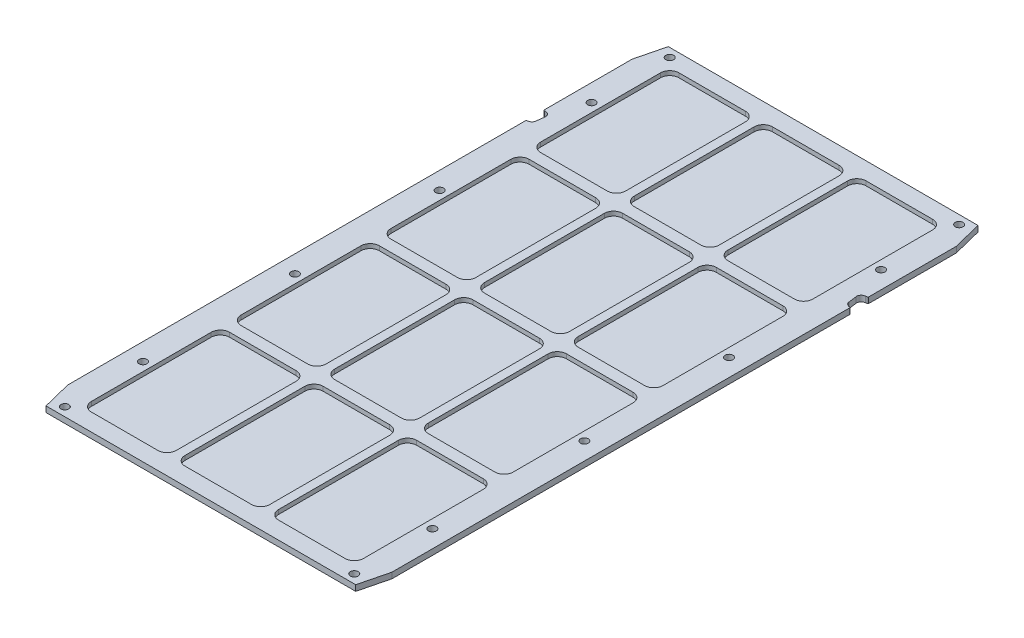
from build123d import *

# Parameters (mm, degrees)
SKETCH1_W           = 112
SKETCH1_H           = 215
BOSS_EXTRUDE1_DEPTH = 2
SKETCH2_W           = 29.333333333
SKETCH2_H           = 47.75
SKETCH2_W_2         = 29.333333334
CUT_EXTRUDE1_DEPTH  = 1.5
CUT_EXTRUDE2_DEPTH  = 122.228090804
SKETCH4_R           = 1.35
CUT_EXTRUDE3_DEPTH  = 122.228090804
FILLET1_R           = 3.175
FILLET2_R           = 3.175
CUT_EXTRUDE4_DEPTH  = 122.228090804
FILLET3_R           = 0.3


with BuildPart() as part:
    # Sketch1 → Boss-Extrude1 (new body)
    with BuildSketch(Plane(origin=(0, 0, 0), x_dir=(1, 0, 0), z_dir=(0, 1, 0))):
        Rectangle(SKETCH1_W, SKETCH1_H)
    extrude(amount=BOSS_EXTRUDE1_DEPTH)

    # Sketch2 → Cut-Extrude1 (cut)
    with BuildSketch(Plane(origin=(0, 2, 0), x_dir=(1, 0, 0), z_dir=(0, 1, 0))):
        with Locations((-32.333333334, 77.625)):
            Rectangle(SKETCH2_W, SKETCH2_H)
        with Locations((-32.333333334, 25.875)):
            Rectangle(SKETCH2_W, SKETCH2_H)
        with Locations((0, 77.625)):
            Rectangle(SKETCH2_W_2, SKETCH2_H)
        with Locations((0, 25.875)):
            Rectangle(SKETCH2_W_2, SKETCH2_H)
        with Locations((-32.333333334, -25.875)):
            Rectangle(SKETCH2_W, SKETCH2_H)
        with Locations((32.333333334, 77.625)):
            Rectangle(SKETCH2_W, SKETCH2_H)
        with Locations((32.333333334, 25.875)):
            Rectangle(SKETCH2_W, SKETCH2_H)
        with Locations((0, -25.875)):
            Rectangle(SKETCH2_W_2, SKETCH2_H)
        with Locations((32.333333334, -25.875)):
            Rectangle(SKETCH2_W, SKETCH2_H)
        with Locations((32.333333334, -77.625)):
            Rectangle(SKETCH2_W, SKETCH2_H)
        with Locations((0, -77.625)):
            Rectangle(SKETCH2_W_2, SKETCH2_H)
        with Locations((-32.333333334, -77.625)):
            Rectangle(SKETCH2_W, SKETCH2_H)
    extrude(amount=-CUT_EXTRUDE1_DEPTH, mode=Mode.SUBTRACT)

    # Sketch3 → Cut-Extrude2 (cut, through all)
    with BuildSketch(Plane(origin=(0, 2, 0), x_dir=(1, 0, 0), z_dir=(0, 1, 0))):
        Polygon((-56, 107.5), (-53.5, 107.5), (-56, 97.5), align=None)
        Polygon((56, 107.5), (53.5, 107.5), (56, 97.5), align=None)
        Polygon((56, -107.5), (56, -97.5), (53.5, -107.5), align=None)
        Polygon((-56, -107.5), (-56, -97.5), (-53.5, -107.5), align=None)
    extrude(amount=-CUT_EXTRUDE2_DEPTH, mode=Mode.SUBTRACT)

    # Sketch4 → Cut-Extrude3 (cut, through all)
    with BuildSketch(Plane(origin=(0, 2, 0), x_dir=(1, 0, 0), z_dir=(0, 1, 0))):
        with Locations(Location((-50, 104.5, 0), (0, 0, 270))):
            Circle(SKETCH4_R)
        with Locations(Location((-50, -104.5, 0), (0, 0, 270))):
            Circle(SKETCH4_R)
        with Locations(Location((50, -104.5, 0), (0, 0, 90))):
            Circle(SKETCH4_R)
        with Locations(Location((50, -25, 0), (0, 0, 90))):
            Circle(SKETCH4_R)
        with Locations(Location((50, 25, 0), (0, 0, 90))):
            Circle(SKETCH4_R)
        with Locations(Location((50, 104.5, 0), (0, 0, 90))):
            Circle(SKETCH4_R)
        with Locations(Location((-50, 77.5, 0), (0, 0, 270))):
            Circle(SKETCH4_R)
        with Locations(Location((-50, 25, 0), (0, 0, 270))):
            Circle(SKETCH4_R)
        with Locations(Location((-50, -25, 0), (0, 0, 270))):
            Circle(SKETCH4_R)
        with Locations(Location((-50, -77.5, 0), (0, 0, 270))):
            Circle(SKETCH4_R)
        with Locations(Location((50, -77.5, 0), (0, 0, 270))):
            Circle(SKETCH4_R)
        with Locations(Location((50, 77.5, 0), (0, 0, 270))):
            Circle(SKETCH4_R)
    extrude(amount=-CUT_EXTRUDE3_DEPTH, mode=Mode.SUBTRACT)

    # Fillet1
    fillet1_edges = [part.edges().sort_by_distance(p)[0] for p in [
        (-17.666666667, 1.25, -101.5),
        (-17.666666667, 1.25, -53.75),
        (-47, 1.25, -53.75),
        (-47, 1.25, -101.5),
        (-47, 1.25, 101.5),
        (-47, 1.25, 53.75),
        (-17.666666667, 1.25, 101.5),
        (14.666666667, 1.25, 53.75),
        (14.666666667, 1.25, 101.5),
        (-14.666666667, 1.25, 101.5),
        (-14.666666667, 1.25, 53.75),
        (47, 1.25, 53.75),
        (47, 1.25, 101.5),
        (17.666666667, 1.25, 101.5),
        (17.666666667, 1.25, 53.75),
        (17.666666667, 1.25, -53.75),
        (17.666666667, 1.25, -101.5),
        (47, 1.25, -101.5),
        (47, 1.25, -53.75),
        (-14.666666667, 1.25, -2),
        (-14.666666667, 1.25, -49.75),
        (14.666666667, 1.25, -49.75),
        (14.666666667, 1.25, -2),
        (-14.666666667, 1.25, -53.75),
        (-14.666666667, 1.25, -101.5),
        (14.666666667, 1.25, -101.5),
        (14.666666667, 1.25, -53.75),
        (-47, 1.25, -2),
        (-47, 1.25, -49.75),
        (-17.666666667, 1.25, -2),
        (47, 1.25, 2),
        (47, 1.25, 49.75),
        (17.666666667, 1.25, 49.75),
        (17.666666667, 1.25, 2),
        (14.666666667, 1.25, 2),
        (14.666666667, 1.25, 49.75),
        (-14.666666667, 1.25, 49.75),
        (-14.666666667, 1.25, 2),
        (-17.666666667, 1.25, 49.75),
        (-47, 1.25, 49.75),
        (-47, 1.25, 2),
        (17.666666667, 1.25, -2),
        (17.666666667, 1.25, -49.75),
        (47, 1.25, -49.75),
        (47, 1.25, -2),
    ]]
    fillet(fillet1_edges, radius=FILLET1_R)

    # Fillet2
    fillet2_edges = [part.edges().sort_by_distance(p)[0] for p in [
        (-17.666666667, 1.25, 53.75),
        (-17.666666667, 1.25, -49.75),
        (-17.666666667, 1.25, 2),
    ]]
    fillet(fillet2_edges, radius=FILLET2_R)

    # Sketch9 → Cut-Extrude4 (cut, through all)
    with BuildSketch(Plane(origin=(0, 2, 0), x_dir=(1, 0, 0), z_dir=(0, 1, 0))):
        with BuildLine():
            Line((-56, 66.961249469), (-55.251016984, 66.929117979))
            ThreePointArc((-55.251016984, 66.929117979), (-54.10373807, 66.364425295), (-53.744982789, 65.137061706))
            Line((-53.744982789, 65.137061706), (-54.112689456, 62.327568098))
            ThreePointArc((-54.112689456, 62.327568098), (-54.685065741, 61.302017235), (-55.805706914, 60.950545264))
            ThreePointArc((-55.805706914, 60.950545264), (-56.544843899, 60.751892413), (-56.927023895, 60.088774861))
            Line((-56.927023895, 60.088774861), (-57.5, 60.088774861))
            Line((-57.5, 60.088774861), (-57.5, 66.961249469))
            Line((-57.5, 66.961249469), (-56, 66.961249469))
        make_face()
        with BuildLine():
            Line((57.5, 66.961249469), (57.5, 60.088774861))
            Line((57.5, 60.088774861), (56.927023895, 60.088774861))
            ThreePointArc((56.927023895, 60.088774861), (56.544843899, 60.751892413), (55.805706914, 60.950545264))
            ThreePointArc((55.805706914, 60.950545264), (54.685065741, 61.302017235), (54.112689456, 62.327568098))
            Line((54.112689456, 62.327568098), (53.744982789, 65.137061706))
            ThreePointArc((53.744982789, 65.137061706), (54.10373807, 66.364425295), (55.251016984, 66.929117979))
            Line((55.251016984, 66.929117979), (56, 66.961249469))
            Line((56, 66.961249469), (57.5, 66.961249469))
        make_face()
    extrude(amount=-CUT_EXTRUDE4_DEPTH, mode=Mode.SUBTRACT)

    # Fillet3
    fillet3_edges = [part.edges().sort_by_distance(p)[0] for p in [
        (56, 1, -66.961249469),
        (56, 1, -60.956917999),
        (-56, 1, -60.956917999),
        (-56, 1, -66.961249469),
    ]]
    fillet(fillet3_edges, radius=FILLET3_R)


solid = part.part
